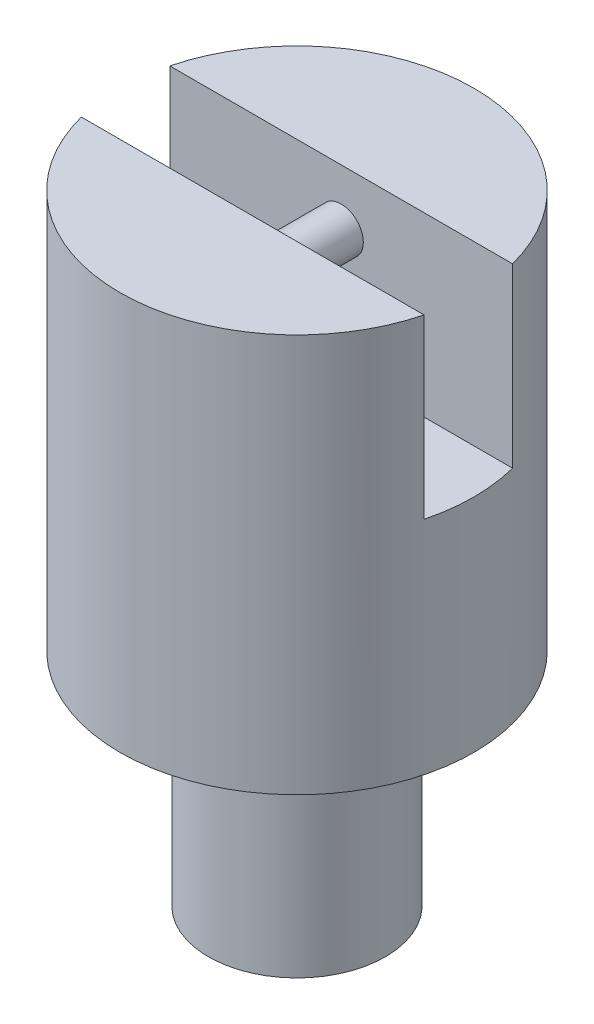
from build123d import *

# Parameters (mm, degrees)
SKETCH1_R           = 50.8
BOSS_EXTRUDE1_DEPTH = 114.3
SKETCH2_R           = 25.4
BOSS_EXTRUDE2_DEPTH = 63.5
SKETCH3_W           = 130.646832002
SKETCH3_H           = 25.4
CUT_EXTRUDE5_DEPTH  = 50.8
SKETCH5_R           = 6.35
BOSS_EXTRUDE3_DEPTH = 50.8


with BuildPart() as part:
    # Sketch1 → Boss-Extrude1 (new body)
    with BuildSketch(Plane(origin=(0, 0, 0), x_dir=(1, 0, 0), z_dir=(0, 1, 0))):
        with Locations(Location((0, 0, 0), (0, 0, 270))):
            Circle(SKETCH1_R)
    extrude(amount=-BOSS_EXTRUDE1_DEPTH)

    # Sketch2 → Boss-Extrude2 (add)
    with BuildSketch(Plane(origin=(0, -114.3, 0), x_dir=(-1, 0, 0), z_dir=(0, -1, 0))):
        with Locations(Location((0, 0, 0), (0, 0, 90))):
            Circle(SKETCH2_R)
    extrude(amount=BOSS_EXTRUDE2_DEPTH)

    # Sketch3 → Cut-Extrude5 (cut)
    with BuildSketch(Plane(origin=(0, 0, 0), x_dir=(1, 0, 0), z_dir=(0, 1, 0))):
        Rectangle(SKETCH3_W, SKETCH3_H)
    extrude(amount=-CUT_EXTRUDE5_DEPTH, mode=Mode.SUBTRACT)

    # Sketch5 → Boss-Extrude3 (add)
    with BuildSketch(Plane(origin=(0, 0, 12.7), x_dir=(-1, 0, 0), z_dir=(0, 0, -1))):
        with Locations(Location((0, -16.075927957, 0), (0, 0, 180))):
            Circle(SKETCH5_R)
    extrude(amount=BOSS_EXTRUDE3_DEPTH)


solid = part.part
